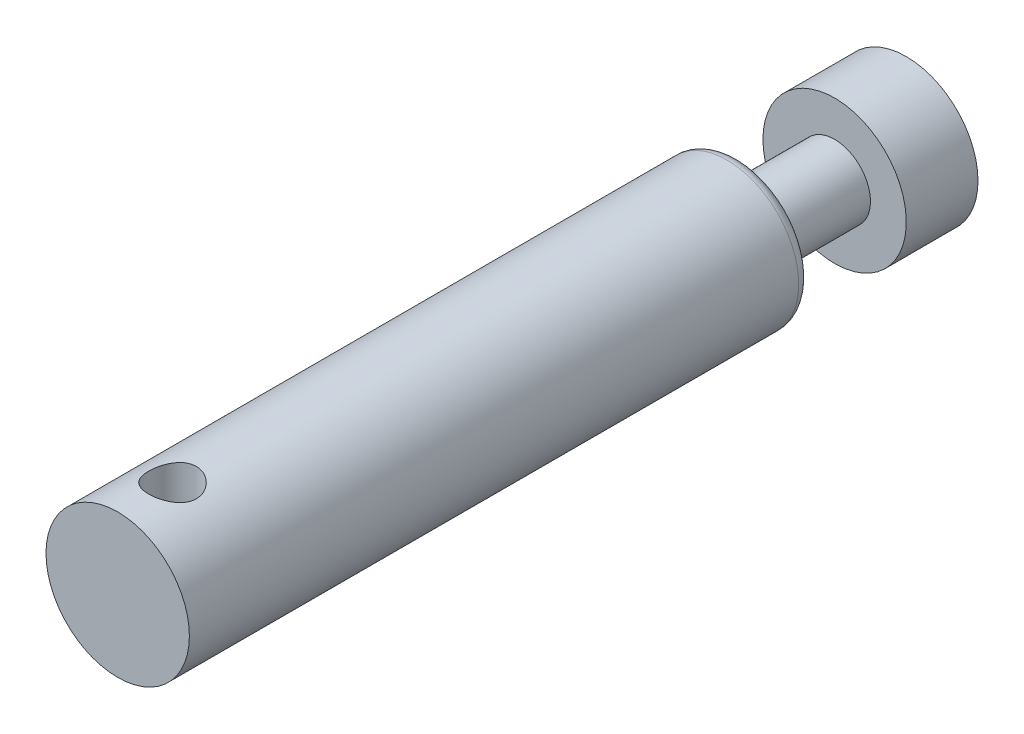
from build123d import *

# Parameters (mm, degrees)
SKETCH1_R               = 3
BOSS_EXTRUDE1_DEPTH     = 33
SKETCH2_W               = 1.5
SKETCH2_H               = 4
FILLET2_R               = 0.5
CUT_EXTRUDE2_DEPTH      = 34.271609528
CUT_EXTRUDE2_DEPTH_BACK = 34.271609528
SKETCH3_R               = 1


with BuildPart() as part:
    # Sketch1 → Boss-Extrude1 (new body)
    with BuildSketch(Plane.XY):
        Circle(SKETCH1_R)
    extrude(amount=BOSS_EXTRUDE1_DEPTH)

    # Sketch2 → Cut-Revolve1 (revolve, cut)
    with BuildSketch(Plane(origin=(0, 0, 0), x_dir=(1, 0, 0), z_dir=(0, 1, 0)), mode=Mode.PRIVATE) as cut_revolve1_sk:
        with Locations((2.25, -5)):
            Rectangle(SKETCH2_W, SKETCH2_H)
    revolve(cut_revolve1_sk.sketch.rotate(Axis((0, 0, 0), (0, 0, 1)), 180), axis=Axis((0, 0, 0), (0, 0, 1)), mode=Mode.SUBTRACT)

    # Fillet2
    fillet2_edges = [part.edges().sort_by_distance(p)[0] for p in [
        (-3, 0, 7),
    ]]
    fillet(fillet2_edges, radius=FILLET2_R)

    # Sketch3 → Cut-Extrude2 (cut, two sides: drawn at the far end of the back side and taken through both)
    with BuildSketch(Plane(origin=(0, 0, 0), x_dir=(1, 0, 0), z_dir=(0, 1, 0)).offset(-CUT_EXTRUDE2_DEPTH_BACK)):
        with Locations(Location((0, -30.706648015, 0), (0, 0, 270))):
            Circle(SKETCH3_R)
    extrude(amount=CUT_EXTRUDE2_DEPTH + CUT_EXTRUDE2_DEPTH_BACK, mode=Mode.SUBTRACT)


solid = part.part
